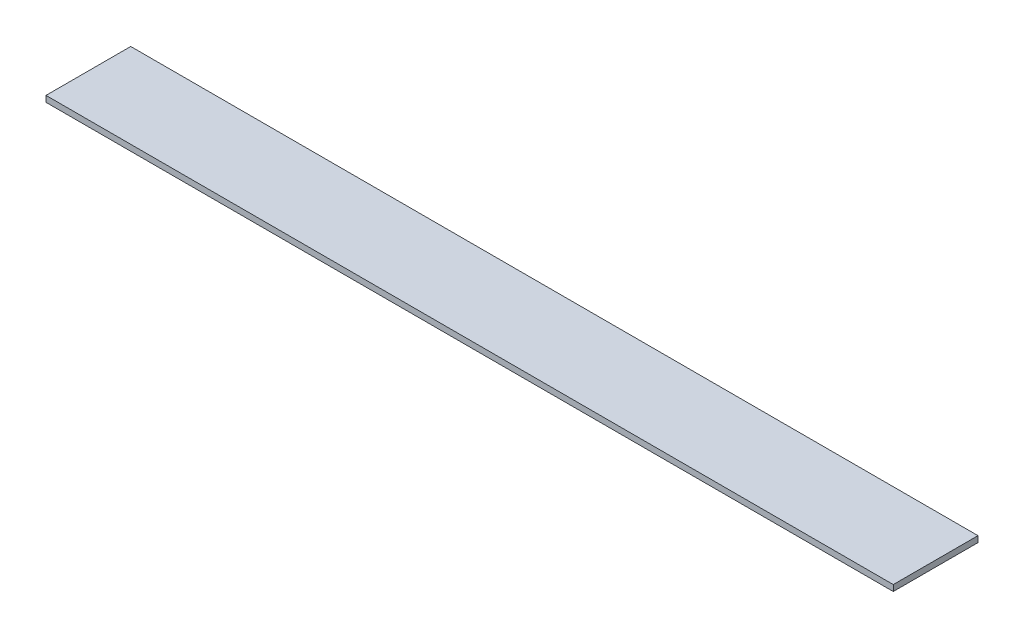
from build123d import *

# Parameters (mm, degrees)
SKETCH1_W           = 140
SKETCH1_H           = 10
BOSS_EXTRUDE1_DEPTH = 1400


with BuildPart() as part:
    # Sketch1 → Boss-Extrude1 (new body)
    with BuildSketch(Plane(origin=(0, 0, 0), x_dir=(0, 0, -1), z_dir=(1, 0, 0))):
        with Locations((70, -5)):
            Rectangle(SKETCH1_W, SKETCH1_H)
    extrude(amount=BOSS_EXTRUDE1_DEPTH)


solid = part.part
